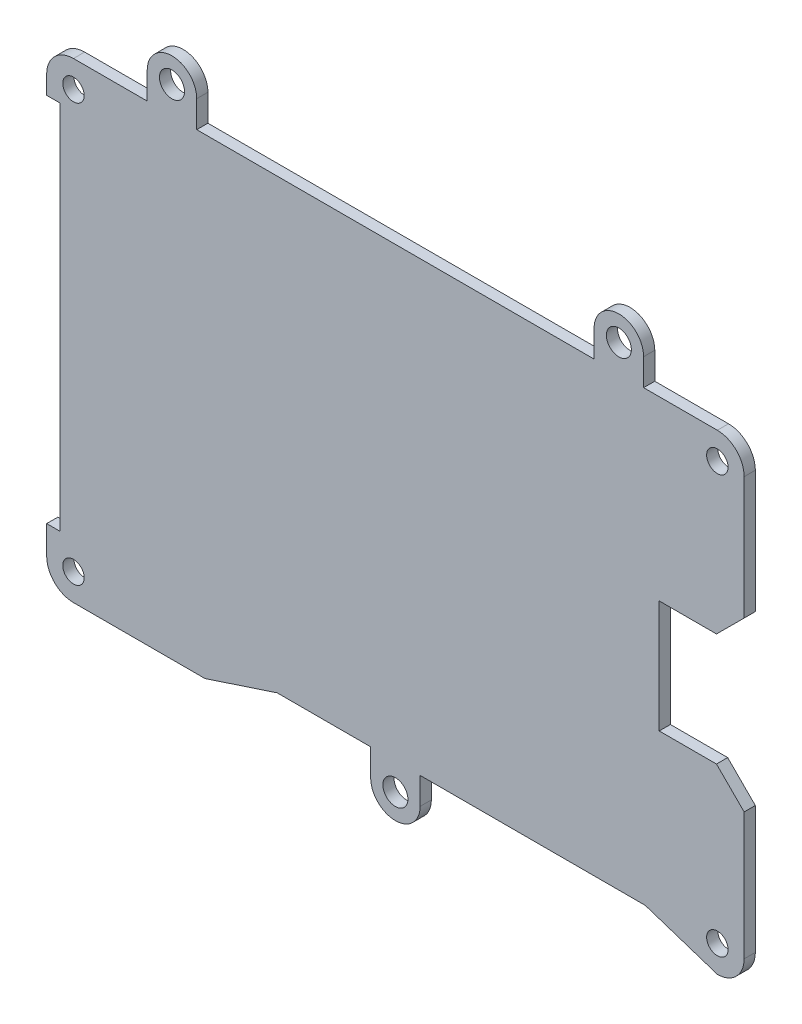
from build123d import *

# Parameters (mm, degrees)
SKETCH1_R           = 1.355900406
BOSS_EXTRUDE1_DEPTH = 1.5875
SKETCH3_R           = 1.524
CUT_EXTRUDE1_DEPTH  = 430.891114182
SKETCH5_W           = 2.0955
SKETCH5_H           = 13.208
BOSS_EXTRUDE3_DEPTH = 1.5875
CUT_EXTRUDE2_DEPTH  = 430.891114182
SKETCH6_R           = 1.778
BOSS_EXTRUDE4_DEPTH = 1.5875


with BuildPart() as part:
    # Sketch1 → Boss-Extrude1 (new body)
    with BuildSketch(Plane.XY):
        with BuildLine():
            Line((-301.9473, 111.74645), (-305.87795, 115.6771))
            Line((-305.87795, 115.6771), (-316.1078, 115.6771))
            Line((-316.1078, 115.6771), (-316.1078, 128.8851))
            Line((-316.1078, 128.8851), (-305.87795, 128.8851))
            Line((-305.87795, 128.8851), (-301.9473, 132.81575))
            Line((-301.9473, 132.81575), (-301.9473, 150.9704))
            ThreePointArc((-301.9473, 150.9704), (-303.063223164, 153.664476836), (-305.7573, 154.7804))
            Line((-305.7573, 154.7804), (-397.247125, 154.7804))
            ThreePointArc((-397.247125, 154.7804), (-399.946077222, 153.659592612), (-401.0571, 150.956597849))
            Line((-401.0571, 150.956597849), (-401.0571, 148.341))
            Line((-401.0571, 148.341), (-399.1521, 148.341))
            Line((-399.1521, 148.341), (-399.1521, 95.6449))
            Line((-399.1521, 95.6449), (-401.0571, 95.6449))
            Line((-401.0571, 95.6449), (-401.0571, 91.659304166))
            ThreePointArc((-401.0571, 91.659304166), (-399.951018769, 88.947400452), (-397.2472, 87.8217))
            Line((-397.2472, 87.8217), (-378.5565, 87.8217))
            Line((-378.5565, 87.8217), (-368.3165, 91.1883))
            Line((-368.3165, 91.1883), (-315.9973, 91.1883))
            Line((-315.9973, 91.1883), (-305.7573, 87.8217))
            ThreePointArc((-305.7573, 87.8217), (-303.063223164, 88.937623164), (-301.9473, 91.6317))
            Line((-301.9473, 91.6317), (-301.9473, 111.74645))
        make_face()
        with Locations((-305.7573, 91.6317)):
            Circle(SKETCH1_R, mode=Mode.SUBTRACT)
        with Locations((-305.7573, 150.9704)):
            Circle(SKETCH1_R, mode=Mode.SUBTRACT)
        with Locations((-397.247125, 150.9704)):
            Circle(SKETCH1_R, mode=Mode.SUBTRACT)
        with Locations((-397.2472, 91.6317)):
            Circle(SKETCH1_R, mode=Mode.SUBTRACT)
    extrude(amount=BOSS_EXTRUDE1_DEPTH)

    # Sketch3 → Cut-Extrude1 (cut, through all)
    with BuildSketch(Plane.XY.offset(1.5875)):
        with Locations((-397.247125, 150.9704)):
            Circle(SKETCH3_R)
        with Locations((-305.7573, 150.9704)):
            Circle(SKETCH3_R)
        with Locations((-305.7573, 91.6317)):
            Circle(SKETCH3_R)
        with Locations((-397.2472, 91.6317)):
            Circle(SKETCH3_R)
    extrude(amount=-CUT_EXTRUDE1_DEPTH, mode=Mode.SUBTRACT)

    # Sketch5 → Boss-Extrude3 (add)
    with BuildSketch(Plane.XY.offset(1.5875)):
        with Locations((-315.06005, 122.2811)):
            Rectangle(SKETCH5_W, SKETCH5_H)
    extrude(amount=-BOSS_EXTRUDE3_DEPTH)

    # Sketch4 → Cut-Extrude2 (cut, through all)
    with BuildSketch(Plane.XY.offset(1.5875)):
        Polygon((-301.9473, 133.571034757), (-305.87795, 129.6471), (-314.0123, 129.6471), (-314.0123, 113.6451), (-305.87795, 113.6451), (-301.9473, 109.71445), align=None)
    extrude(amount=-CUT_EXTRUDE2_DEPTH, mode=Mode.SUBTRACT)

    # Sketch6 → Boss-Extrude4 (add)
    # profile 1 of 3: a face of its own
    with BuildSketch(Plane(origin=(0, 0, 0), x_dir=(-1, 0, 0), z_dir=(0, 0, -1))):
        with BuildLine():
            Line((386.7701125, 154.7804), (386.7701125, 158.5904))
            ThreePointArc((386.7701125, 158.5904), (383.2522125, 162.1083), (379.7343125, 158.5904))
            Line((379.7343125, 158.5904), (379.7343125, 154.7804))
            Line((379.7343125, 154.7804), (386.7701125, 154.7804))
        make_face()
        with Locations((383.2522125, 158.5904)):
            Circle(SKETCH6_R, mode=Mode.SUBTRACT)
    # profile 2 of 3: a face of its own
    with BuildSketch(Plane(origin=(0, 0, 0), x_dir=(-1, 0, 0), z_dir=(0, 0, -1))):
        with BuildLine():
            Line((347.9843125, 91.1883), (347.9843125, 87.3783))
            ThreePointArc((347.9843125, 87.3783), (351.5022125, 83.8604), (355.0201125, 87.3783))
            Line((355.0201125, 87.3783), (355.0201125, 91.1883))
            Line((355.0201125, 91.1883), (347.9843125, 91.1883))
        make_face()
        with Locations((351.5022125, 87.3783)):
            Circle(SKETCH6_R, mode=Mode.SUBTRACT)
    # profile 3 of 3: a face of its own
    with BuildSketch(Plane(origin=(0, 0, 0), x_dir=(-1, 0, 0), z_dir=(0, 0, -1))):
        with BuildLine():
            Line((316.2343125, 158.5904), (316.2343125, 154.7804))
            Line((316.2343125, 154.7804), (323.2701125, 154.7804))
            Line((323.2701125, 154.7804), (323.2701125, 158.5904))
            ThreePointArc((323.2701125, 158.5904), (319.7522125, 162.1083), (316.2343125, 158.5904))
        make_face()
        with Locations((319.7522125, 158.5904)):
            Circle(SKETCH6_R, mode=Mode.SUBTRACT)
    extrude(amount=-BOSS_EXTRUDE4_DEPTH)


solid = part.part
